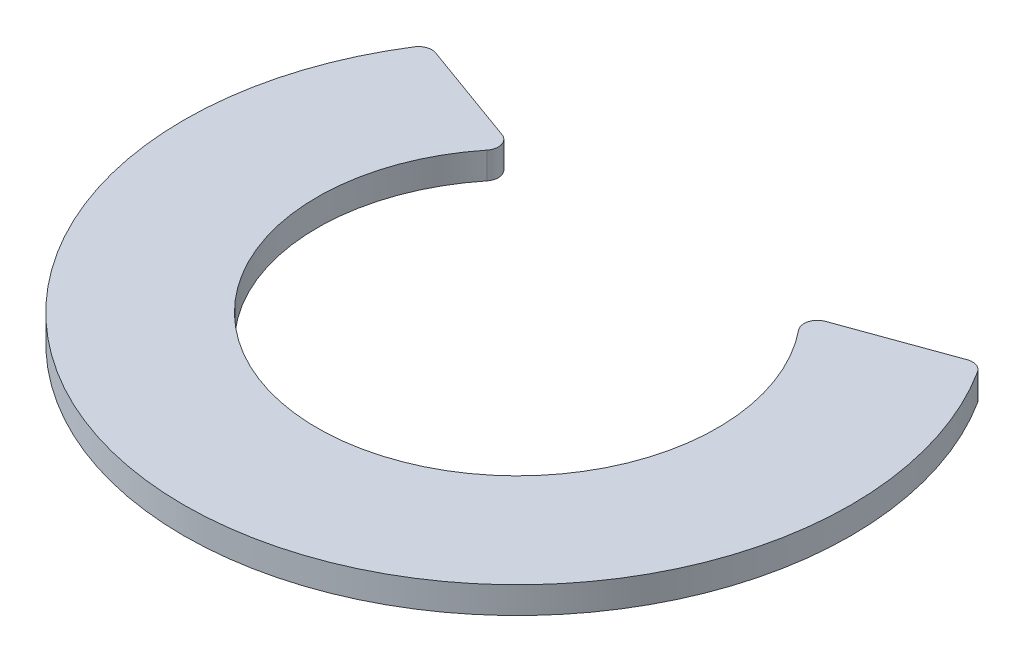
from build123d import *

# Parameters (mm, degrees)
SALIENTE_EXTRUIR1_DEPTH = 0.2


with BuildPart() as part:
    # Croquis1 → Saliente-Extruir1 (new body)
    with BuildSketch(Plane(origin=(0, 0, 0), x_dir=(1, 0, 0), z_dir=(0, 1, 0))):
        with BuildLine():
            Line((-1.992524634, 1.379782019), (-1.212185587, 1.097524004))
            ThreePointArc((-1.212185587, 1.097524004), (-1.149900682, 1.030439191), (-1.168312517, 0.940768762))
            ThreePointArc((-1.168312517, 0.940768762), (0, -1.5), (1.168312517, 0.940768762))
            ThreePointArc((1.168312517, 0.940768762), (1.149900682, 1.030439191), (1.212185587, 1.097524004))
            Line((1.212185587, 1.097524004), (1.992524634, 1.379782019))
            ThreePointArc((1.992524634, 1.379782019), (2.058865665, 1.380375507), (2.110978193, 1.339317389))
            ThreePointArc((2.110978193, 1.339317389), (0, -2.5), (-2.110978193, 1.339317389))
            ThreePointArc((-2.110978193, 1.339317389), (-2.058865665, 1.380375507), (-1.992524634, 1.379782019))
        make_face()
    extrude(amount=SALIENTE_EXTRUIR1_DEPTH)


solid = part.part
